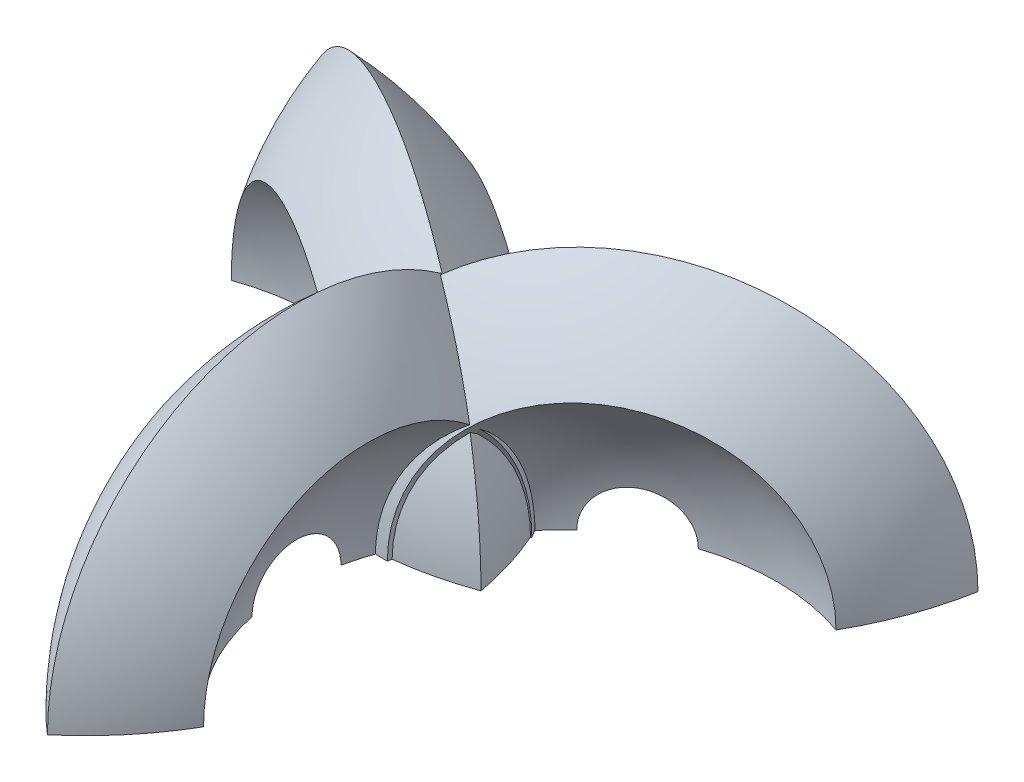
from build123d import *

# Parameters (mm, degrees)
F_4_5_LEG_REVOLVE_ANGLE = 180
F_1_6_LEG_REVOLVE_ANGLE = 180
F_2_3_LEG_REVOLVE_ANGLE = 180


with BuildPart() as part:
    # Sketch4 → 4-5 leg revolve (revolve, symmetric)
    with BuildSketch(Plane.XY.offset(84.650501395)) as f_4_5_leg_revolve_sk:
        with BuildLine():
            ThreePointArc((41.52641309, 96.695760248), (14.715809322, 64.933806829), (-0.403929917, 26.216580111))
            ThreePointArc((-0.403929917, 26.216580111), (-15.523669157, 64.933806829), (-42.334272925, 96.695760248))
            ThreePointArc((-42.334272925, 96.695760248), (-23.50790032, 123.504386992), (-0.403929917, 146.728110315))
            ThreePointArc((-0.403929917, 146.728110315), (22.700040485, 123.504386992), (41.52641309, 96.695760248))
        make_face()
    revolve(axis=Axis((-124.668530377, 0, 84.650501395), (1, 0, 0)), revolution_arc=F_4_5_LEG_REVOLVE_ANGLE / 2)
    revolve(f_4_5_leg_revolve_sk.sketch, axis=Axis((-124.668530377, 0, 84.650501395), (-1, 0, 0)), revolution_arc=F_4_5_LEG_REVOLVE_ANGLE / 2)

    # Sketch5 → 1-6 leg revolve (revolve, symmetric)
    with BuildSketch(Plane(origin=(73.448953951, 0, -42.617307843), x_dir=(-0.5018671305259788, 0, -0.8649447284639755), z_dir=(0.8649447284639755, 0, -0.5018671305259788))) as f_1_6_leg_revolve_sk:
        with BuildLine():
            ThreePointArc((41.343119895, 96.695430947), (14.532414899, 64.932986617), (-0.587125541, 26.215209445))
            ThreePointArc((-0.587125541, 26.215209445), (-15.70666598, 64.932986617), (-42.517370976, 96.695430947))
            ThreePointArc((-42.517370976, 96.695430947), (-23.691050832, 123.504095778), (-0.587125541, 146.727865418))
            ThreePointArc((-0.587125541, 146.727865418), (22.516799751, 123.504095778), (41.343119895, 96.695430947))
        make_face()
    revolve(axis=Axis((136.108076543, 0, 65.372784514), (-0.5018671305259786, 0, -0.8649447284639755)), revolution_arc=F_1_6_LEG_REVOLVE_ANGLE / 2)
    revolve(f_1_6_leg_revolve_sk.sketch, axis=Axis((136.108076543, 0, 65.372784514), (0.5018671305259786, 0, 0.8649447284639755)), revolution_arc=F_1_6_LEG_REVOLVE_ANGLE / 2)

    # Sketch6 → 2-3 leg revolve (revolve, symmetric)
    with BuildSketch(Plane(origin=(-73.632148208, 0, -42.300006082), x_dir=(-0.4981305424562493, 0, 0.8671020485918846), z_dir=(-0.8671020485918844, 0, -0.49813054245624927))) as f_2_3_leg_revolve_sk:
        with BuildLine():
            ThreePointArc((41.343119895, 96.695430947), (14.532414899, 64.932986617), (-0.587125541, 26.215209445))
            ThreePointArc((-0.587125541, 26.215209445), (-15.70666598, 64.932986617), (-42.517370976, 96.695430947))
            ThreePointArc((-42.517370976, 96.695430947), (-23.691050832, 123.504095778), (-0.587125541, 146.727865418))
            ThreePointArc((-0.587125541, 146.727865418), (22.516799751, 123.504095778), (41.343119895, 96.695430947))
        make_face()
    revolve(axis=Axis((-11.439546167, 0, -150.559444204), (-0.4981305424562494, 0, 0.8671020485918846)), revolution_arc=F_2_3_LEG_REVOLVE_ANGLE / 2)
    revolve(f_2_3_leg_revolve_sk.sketch, axis=Axis((-11.439546167, 0, -150.559444204), (0.4981305424562494, 0, -0.8671020485918846)), revolution_arc=F_2_3_LEG_REVOLVE_ANGLE / 2)


solid = part.part
